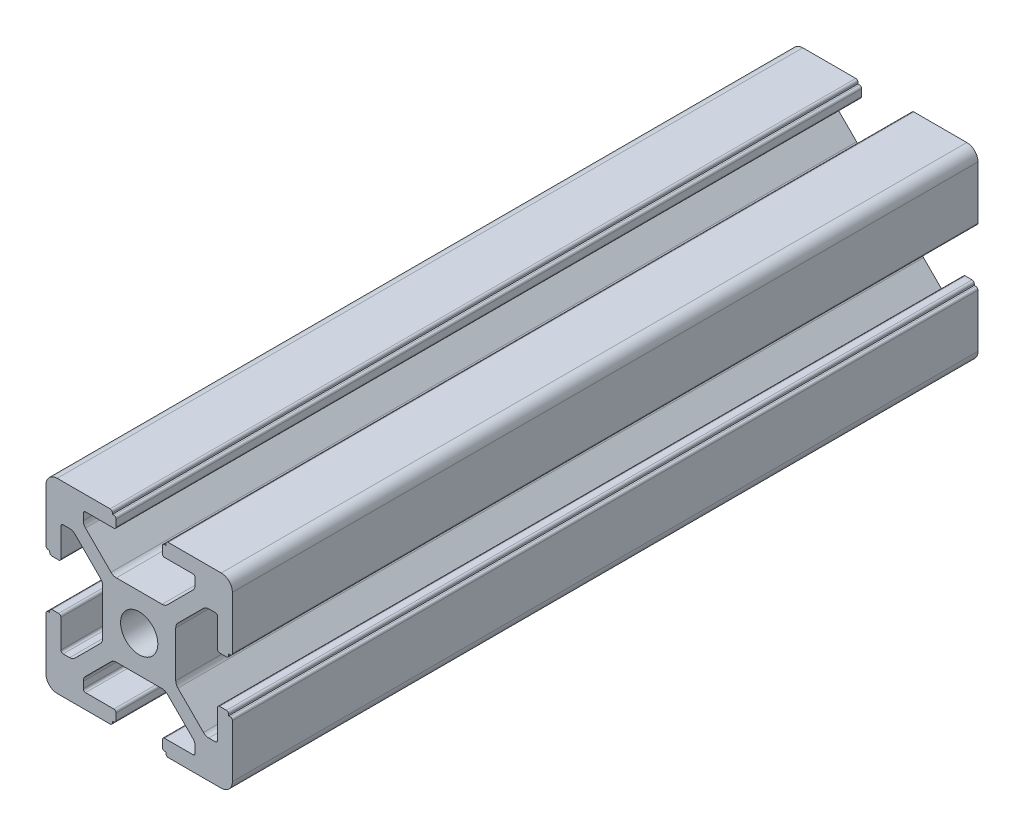
from build123d import *

# Parameters (mm, degrees)
SKETCH_1_R      = 2.5
EXTRUDE_1_DEPTH = 100


with BuildPart() as part:
    # 草图1 → 凸台-拉伸1 (new body)
    with BuildSketch(Plane.XY):
        with BuildLine():
            Line((-11.580766307, 11.574521058), (-11.580766307, 4.474521058))
            ThreePointArc((-11.580766307, 4.474521058), (-11.492898341, 4.262389024), (-11.280766307, 4.174521058))
            Line((-11.280766307, 4.174521058), (-11.080766307, 4.174521058))
            Line((-11.080766307, 4.174521058), (-11.080766307, 3.974521058))
            ThreePointArc((-11.080766307, 3.974521058), (-10.992898341, 3.762389024), (-10.780766307, 3.674521058))
            Line((-10.780766307, 3.674521058), (-9.880766307, 3.674521058))
            ThreePointArc((-9.880766307, 3.674521058), (-9.668634272, 3.762389024), (-9.580766307, 3.974521058))
            Line((-9.580766307, 3.974521058), (-9.580766307, 7.774521058))
            ThreePointArc((-9.580766307, 7.774521058), (-9.492898341, 7.986653093), (-9.280766307, 8.074521058))
            Line((-9.280766307, 8.074521058), (-8.409193431, 8.074521058))
            ThreePointArc((-8.409193431, 8.074521058), (-8.026509999, 7.998400591), (-7.70208665, 7.78162784))
            Line((-7.70208665, 7.78162784), (-4.273659525, 4.353200715))
            ThreePointArc((-4.273659525, 4.353200715), (-4.056886774, 4.028777366), (-3.980766307, 3.646093934))
            Line((-3.980766307, 3.646093934), (-3.980766307, -2.497051817))
            ThreePointArc((-3.980766307, -2.497051817), (-4.056886774, -2.879735249), (-4.273659525, -3.204158598))
            Line((-4.273659525, -3.204158598), (-7.70208665, -6.632585723))
            ThreePointArc((-7.70208665, -6.632585723), (-8.026509999, -6.849358474), (-8.409193431, -6.925478942))
            Line((-8.409193431, -6.925478942), (-9.280766307, -6.925478942))
            ThreePointArc((-9.280766307, -6.925478942), (-9.492898341, -6.837610976), (-9.580766307, -6.625478942))
            Line((-9.580766307, -6.625478942), (-9.580766307, -2.825478942))
            ThreePointArc((-9.580766307, -2.825478942), (-9.668634272, -2.613346907), (-9.880766307, -2.525478942))
            Line((-9.880766307, -2.525478942), (-10.780766307, -2.525478942))
            ThreePointArc((-10.780766307, -2.525478942), (-10.992898341, -2.613346907), (-11.080766307, -2.825478942))
            Line((-11.080766307, -2.825478942), (-11.080766307, -3.025478942))
            Line((-11.080766307, -3.025478942), (-11.280766307, -3.025478942))
            ThreePointArc((-11.280766307, -3.025478942), (-11.492898341, -3.113346907), (-11.580766307, -3.325478942))
            Line((-11.580766307, -3.325478942), (-11.580766307, -10.425478942))
            ThreePointArc((-11.580766307, -10.425478942), (-11.141426478, -11.486139113), (-10.080766307, -11.925478942))
            Line((-10.080766307, -11.925478942), (-2.980766307, -11.925478942))
            ThreePointArc((-2.980766307, -11.925478942), (-2.768634272, -11.837610976), (-2.680766307, -11.625478942))
            Line((-2.680766307, -11.625478942), (-2.680766307, -11.425478942))
            Line((-2.680766307, -11.425478942), (-2.480766307, -11.425478942))
            ThreePointArc((-2.480766307, -11.425478942), (-2.268634272, -11.337610976), (-2.180766307, -11.125478942))
            Line((-2.180766307, -11.125478942), (-2.180766307, -10.225478942))
            ThreePointArc((-2.180766307, -10.225478942), (-2.268634272, -10.013346907), (-2.480766307, -9.925478942))
            Line((-2.480766307, -9.925478942), (-6.280766307, -9.925478942))
            ThreePointArc((-6.280766307, -9.925478942), (-6.492898341, -9.837610976), (-6.580766307, -9.625478942))
            Line((-6.580766307, -9.625478942), (-6.580766307, -8.753906066))
            ThreePointArc((-6.580766307, -8.753906066), (-6.504645839, -8.371222634), (-6.287873088, -8.046799285))
            Line((-6.287873088, -8.046799285), (-2.859445963, -4.61837216))
            ThreePointArc((-2.859445963, -4.61837216), (-2.535022614, -4.401599409), (-2.152339182, -4.325478942))
            Line((-2.152339182, -4.325478942), (3.990806569, -4.325478942))
            ThreePointArc((3.990806569, -4.325478942), (4.373490001, -4.401599409), (4.69791335, -4.61837216))
            Line((4.69791335, -4.61837216), (8.126340475, -8.046799285))
            ThreePointArc((8.126340475, -8.046799285), (8.343113226, -8.371222634), (8.419233693, -8.753906066))
            Line((8.419233693, -8.753906066), (8.419233693, -9.625478942))
            ThreePointArc((8.419233693, -9.625478942), (8.331365728, -9.837610976), (8.119233693, -9.925478942))
            Line((8.119233693, -9.925478942), (4.319233693, -9.925478942))
            ThreePointArc((4.319233693, -9.925478942), (4.107101659, -10.013346907), (4.019233693, -10.225478942))
            Line((4.019233693, -10.225478942), (4.019233693, -11.125478942))
            ThreePointArc((4.019233693, -11.125478942), (4.107101659, -11.337610976), (4.319233693, -11.425478942))
            Line((4.319233693, -11.425478942), (4.519233693, -11.425478942))
            Line((4.519233693, -11.425478942), (4.519233693, -11.625478942))
            ThreePointArc((4.519233693, -11.625478942), (4.607101659, -11.837610976), (4.819233693, -11.925478942))
            Line((4.819233693, -11.925478942), (11.919233693, -11.925478942))
            ThreePointArc((11.919233693, -11.925478942), (12.979893865, -11.486139113), (13.419233693, -10.425478942))
            Line((13.419233693, -10.425478942), (13.419233693, -3.325478942))
            ThreePointArc((13.419233693, -3.325478942), (13.331365728, -3.113346907), (13.119233693, -3.025478942))
            Line((13.119233693, -3.025478942), (12.919233693, -3.025478942))
            Line((12.919233693, -3.025478942), (12.919233693, -2.825478942))
            ThreePointArc((12.919233693, -2.825478942), (12.831365728, -2.613346907), (12.619233693, -2.525478942))
            Line((12.619233693, -2.525478942), (11.719233693, -2.525478942))
            ThreePointArc((11.719233693, -2.525478942), (11.507101659, -2.613346907), (11.419233693, -2.825478942))
            Line((11.419233693, -2.825478942), (11.419233693, -6.625478942))
            ThreePointArc((11.419233693, -6.625478942), (11.331365728, -6.837610976), (11.119233693, -6.925478942))
            Line((11.119233693, -6.925478942), (10.247660818, -6.925478942))
            ThreePointArc((10.247660818, -6.925478942), (9.864977386, -6.849358474), (9.540554037, -6.632585723))
            Line((9.540554037, -6.632585723), (6.112126912, -3.204158598))
            ThreePointArc((6.112126912, -3.204158598), (5.895354161, -2.879735249), (5.819233693, -2.497051817))
            Line((5.819233693, -2.497051817), (5.819233693, 3.646093934))
            ThreePointArc((5.819233693, 3.646093934), (5.895354161, 4.028777366), (6.112126912, 4.353200715))
            Line((6.112126912, 4.353200715), (9.540554037, 7.78162784))
            ThreePointArc((9.540554037, 7.78162784), (9.864977386, 7.998400591), (10.247660818, 8.074521058))
            Line((10.247660818, 8.074521058), (11.119233693, 8.074521058))
            ThreePointArc((11.119233693, 8.074521058), (11.331365728, 7.986653093), (11.419233693, 7.774521058))
            Line((11.419233693, 7.774521058), (11.419233693, 3.974521058))
            ThreePointArc((11.419233693, 3.974521058), (11.507101659, 3.762389024), (11.719233693, 3.674521058))
            Line((11.719233693, 3.674521058), (12.619233693, 3.674521058))
            ThreePointArc((12.619233693, 3.674521058), (12.831365728, 3.762389024), (12.919233693, 3.974521058))
            Line((12.919233693, 3.974521058), (12.919233693, 4.174521058))
            Line((12.919233693, 4.174521058), (13.119233693, 4.174521058))
            ThreePointArc((13.119233693, 4.174521058), (13.331365728, 4.262389024), (13.419233693, 4.474521058))
            Line((13.419233693, 4.474521058), (13.419233693, 11.574521058))
            ThreePointArc((13.419233693, 11.574521058), (12.979893865, 12.63518123), (11.919233693, 13.074521058))
            Line((11.919233693, 13.074521058), (4.819233693, 13.074521058))
            ThreePointArc((4.819233693, 13.074521058), (4.607101659, 12.986653093), (4.519233693, 12.774521058))
            Line((4.519233693, 12.774521058), (4.519233693, 12.574521058))
            Line((4.519233693, 12.574521058), (4.319233693, 12.574521058))
            ThreePointArc((4.319233693, 12.574521058), (4.107101659, 12.486653093), (4.019233693, 12.274521058))
            Line((4.019233693, 12.274521058), (4.019233693, 11.374521058))
            ThreePointArc((4.019233693, 11.374521058), (4.107101659, 11.162389024), (4.319233693, 11.074521058))
            Line((4.319233693, 11.074521058), (8.119233693, 11.074521058))
            ThreePointArc((8.119233693, 11.074521058), (8.331365728, 10.986653093), (8.419233693, 10.774521058))
            Line((8.419233693, 10.774521058), (8.419233693, 9.902948183))
            ThreePointArc((8.419233693, 9.902948183), (8.343113226, 9.520264751), (8.126340475, 9.195841402))
            Line((8.126340475, 9.195841402), (4.69791335, 5.767414277))
            ThreePointArc((4.69791335, 5.767414277), (4.373490001, 5.550641526), (3.990806569, 5.474521058))
            Line((3.990806569, 5.474521058), (-2.152339182, 5.474521058))
            ThreePointArc((-2.152339182, 5.474521058), (-2.535022614, 5.550641526), (-2.859445963, 5.767414277))
            Line((-2.859445963, 5.767414277), (-6.287873088, 9.195841402))
            ThreePointArc((-6.287873088, 9.195841402), (-6.504645839, 9.520264751), (-6.580766307, 9.902948183))
            Line((-6.580766307, 9.902948183), (-6.580766307, 10.774521058))
            ThreePointArc((-6.580766307, 10.774521058), (-6.492898341, 10.986653093), (-6.280766307, 11.074521058))
            Line((-6.280766307, 11.074521058), (-2.480766307, 11.074521058))
            ThreePointArc((-2.480766307, 11.074521058), (-2.268634272, 11.162389024), (-2.180766307, 11.374521058))
            Line((-2.180766307, 11.374521058), (-2.180766307, 12.274521058))
            ThreePointArc((-2.180766307, 12.274521058), (-2.268634272, 12.486653093), (-2.480766307, 12.574521058))
            Line((-2.480766307, 12.574521058), (-2.680766307, 12.574521058))
            Line((-2.680766307, 12.574521058), (-2.680766307, 12.774521058))
            ThreePointArc((-2.680766307, 12.774521058), (-2.768634272, 12.986653093), (-2.980766307, 13.074521058))
            Line((-2.980766307, 13.074521058), (-10.080766307, 13.074521058))
            ThreePointArc((-10.080766307, 13.074521058), (-11.141426478, 12.63518123), (-11.580766307, 11.574521058))
        make_face()
        with Locations((0.919233693, 0.574521058)):
            Circle(SKETCH_1_R, mode=Mode.SUBTRACT)
    extrude(amount=EXTRUDE_1_DEPTH)


solid = part.part
